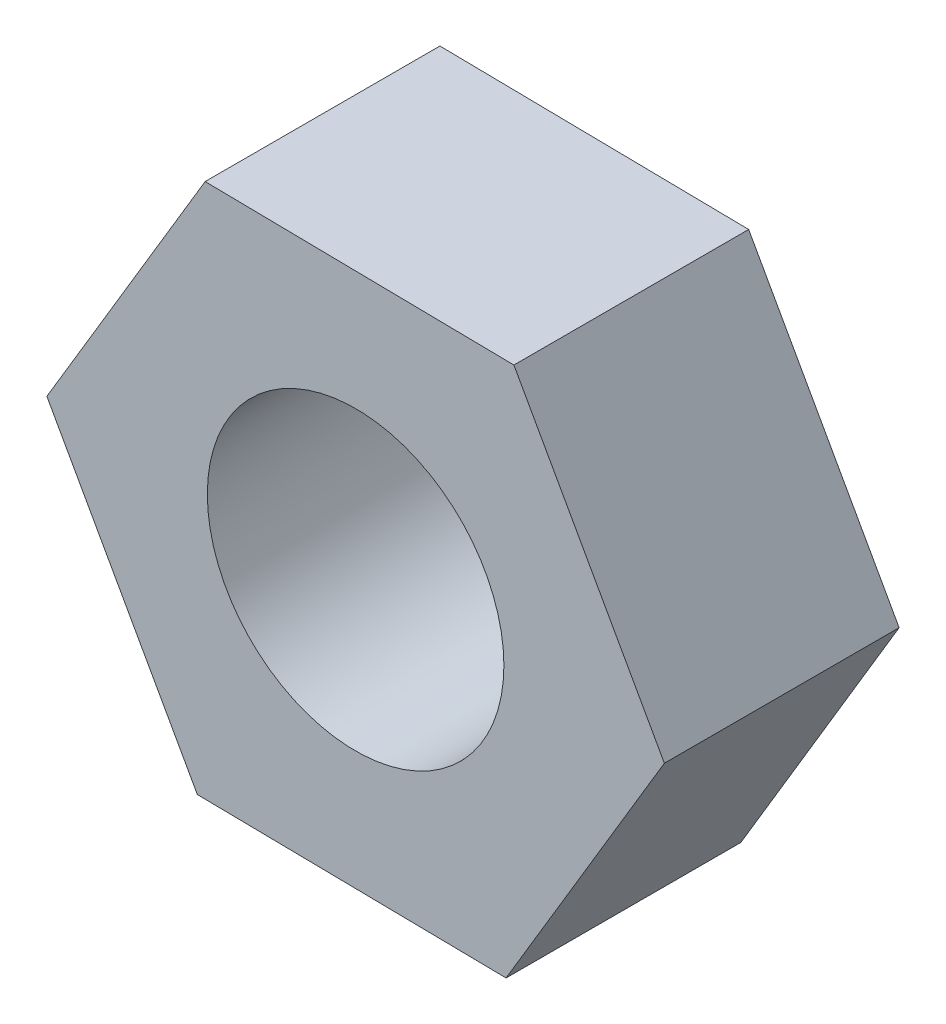
from build123d import *

# Parameters (mm, degrees)
BOSS_EXTRUDE1_DEPTH = 2.3749
SKETCH2_R           = 1.5
CUT_EXTRUDE1_DEPTH  = 2.3749


with BuildPart() as part:
    # Sketch1 → Boss-Extrude1 (new body)
    with BuildSketch(Plane.XY):
        Polygon((1.601178305, 2.681973661), (-1.52206817, 2.727647918), (-3.123246475, 0.045674258), (-1.601178305, -2.681973661), (1.52206817, -2.727647918), (3.123246475, -0.045674258), align=None)
    extrude(amount=BOSS_EXTRUDE1_DEPTH)

    # Sketch2 → Cut-Extrude1 (cut)
    with BuildSketch(Plane.XY.offset(2.3749)):
        Circle(SKETCH2_R)
    extrude(amount=-CUT_EXTRUDE1_DEPTH, mode=Mode.SUBTRACT)


solid = part.part
